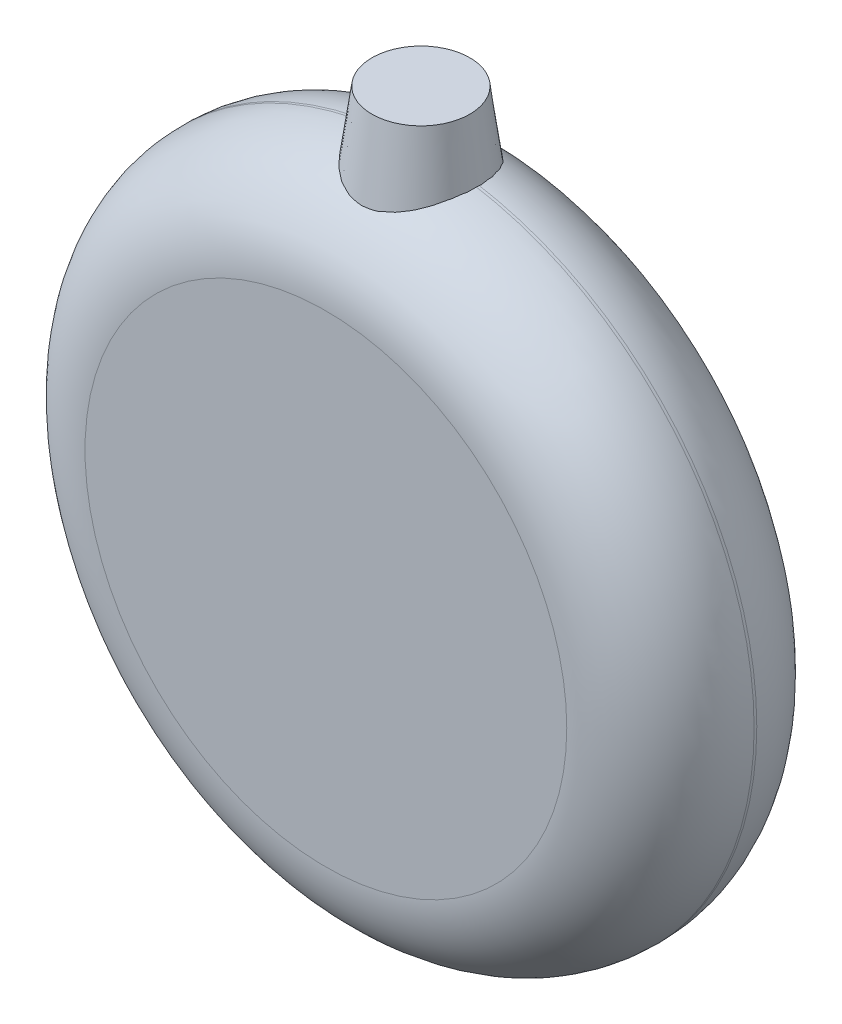
from build123d import *

# Parameters (mm, degrees)
SKETCH1_R           = 25
BOSS_EXTRUDE1_DEPTH = 7.1
BOSS_EXTRUDE2_START = 23
SKETCH4_R           = 4.5
BOSS_EXTRUDE2_DEPTH = 6
BOSS_EXTRUDE2_TAPER = 8
FILLET2_R           = 7
BOSS_EXTRUDE3_DEPTH = 0.1


with BuildPart() as part:
    # Sketch1 → Boss-Extrude1 (new, symmetric)
    with BuildSketch(Plane.XY):
        Circle(SKETCH1_R)
    extrude(amount=BOSS_EXTRUDE1_DEPTH, both=True)

    # Fillet2
    fillet2_edges = [part.edges().sort_by_distance(p)[0] for p in [
        (-25, 0, 7.1),
        (-25, 0, -7.1),
    ]]
    fillet(fillet2_edges, radius=FILLET2_R)

    # Sketch5 → Boss-Extrude3 (add)
    # profile 1 of 3: a face of its own
    with BuildSketch(Plane(origin=(0, 0, -7.1), x_dir=(-1, 0, 0), z_dir=(0, 0, -1))):
        Polygon((8.213261218, -6.2), (7.060697115, -6.2), (5.643589744, -1.875400641), (4.219030449, -6.2), (3.075160256, -6.2), (2.026923077, 0), (3.153405449, 0), (3.815384615, -3.915985577), (5.104567308, 0), (6.188822115, 0), (7.471794872, -3.915985577), (8.132532051, 0), (9.26025641, 0), align=None)
    # profile 2 of 3: a face of its own
    with BuildSketch(Plane(origin=(0, 0, -7.1), x_dir=(-1, 0, 0), z_dir=(0, 0, -1))):
        with BuildLine():
            add(Edge.make_bspline(
                [(-1.892788462, -3.338461538), (-1.957814687, -3.292016811), (-2.086528232, -3.200083664), (-2.256082423, -3.03542489), (-2.403077422, -2.852339794), (-2.525396911, -2.651423244), (-2.623116991, -2.436383636), (-2.690272417, -2.210114258), (-2.735179023, -1.976115948), (-2.739914035, -1.81682388), (-2.742307692, -1.736298077)],
                knots=[0, 0, 0, 0, 1.013470425, 2.00607327, 2.989559212, 3.987547927, 4.985093546, 5.979490292, 6.978585884, 8, 8, 8, 8], degree=3))
            add(Edge.make_bspline(
                [(-2.742307692, -1.736298077), (-2.739368276, -1.649115937), (-2.733538321, -1.476201353), (-2.681865938, -1.222652923), (-2.599340208, -0.97929684), (-2.485494527, -0.74900875), (-2.34341316, -0.538132911), (-2.178774834, -0.349954761), (-1.989121967, -0.192777785), (-1.813970357, -0.084612696), (-1.662159308, -0.014438799), (-1.540636051, 0.033468366), (-1.410221464, 0.071230849), (-1.273091306, 0.103710579), (-1.127814736, 0.128061881), (-0.975821963, 0.147231139), (-0.815688033, 0.156527408), (-0.706699573, 0.158144818), (-0.650801282, 0.158974359)],
                knots=[0, 0, 0, 0, 1.313633616, 2.605423678, 3.884827599, 5.180399172, 6.467003699, 7.709825993, 8.937691468, 10.168030689, 10.802071053, 11.45831639, 12.135866991, 12.84764728, 13.582572811, 14.35620613, 15.156926628, 16, 16, 16, 16], degree=3))
            add(Edge.make_bspline(
                [(-0.650801282, 0.158974359), (-0.591176124, 0.158160994), (-0.474739947, 0.156572652), (-0.304750979, 0.147085787), (-0.144467791, 0.12925788), (0.006835878, 0.106827755), (0.147772465, 0.073519785), (0.28021432, 0.037309023), (0.402728778, -0.007674839), (0.55248756, -0.077055439), (0.726079973, -0.18081648), (0.911348168, -0.33594284), (1.076422799, -0.517827085), (1.214675963, -0.727771842), (1.329877805, -0.95685246), (1.412093921, -1.203917306), (1.461614276, -1.465629795), (1.467511337, -1.645001531), (1.470512821, -1.736298077)],
                knots=[0, 0, 0, 0, 0.887187828, 1.732502891, 2.531768656, 3.28622382, 4.00645991, 4.68503301, 5.328123524, 5.945476897, 7.13918604, 8.324554323, 9.528234031, 10.780485522, 12.053158567, 13.332907357, 14.642504384, 16, 16, 16, 16], degree=3))
            add(Edge.make_bspline(
                [(1.470512821, -1.736298077), (1.468464894, -1.815975357), (1.464438103, -1.972643002), (1.422555417, -2.20130756), (1.358699234, -2.42001094), (1.265373076, -2.626739984), (1.148202994, -2.823996227), (1.002257938, -3.007732339), (0.832518432, -3.182446151), (0.703346025, -3.285593788), (0.637139423, -3.338461538)],
                knots=[0, 0, 0, 0, 1.017680362, 2.001042016, 2.962316111, 3.924347734, 4.892953533, 5.888308623, 6.917664266, 8, 8, 8, 8], degree=3))
            add(Edge.make_bspline(
                [(0.637139423, -3.338461538), (0.678186098, -3.385777204), (0.758994639, -3.478927498), (0.863290645, -3.628969605), (0.952293467, -3.783363075), (1.024111976, -3.943021129), (1.08185441, -4.10610318), (1.123389488, -4.273612859), (1.147010007, -4.446052142), (1.150700193, -4.562577452), (1.152564103, -4.621434295)],
                knots=[0, 0, 0, 0, 1.06167017, 2.090108827, 3.093337593, 4.079993162, 5.054811602, 6.023746282, 7.001795783, 8, 8, 8, 8], degree=3))
            add(Edge.make_bspline(
                [(1.152564103, -4.621434295), (1.150112139, -4.70111505), (1.145274509, -4.858322112), (1.101637153, -5.08842811), (1.030800778, -5.30783801), (0.930868786, -5.513666333), (0.80789391, -5.703971348), (0.659018726, -5.872201561), (0.488632691, -6.019204755), (0.295733787, -6.141936244), (0.083723613, -6.238919389), (-0.145068883, -6.30863371), (-0.389588161, -6.351912974), (-0.558297189, -6.356584756), (-0.644591346, -6.358974359)],
                knots=[0, 0, 0, 0, 1.022461855, 2.017277858, 2.995792987, 3.975491763, 4.947267477, 5.896545572, 6.850353789, 7.828175386, 8.82259352, 9.83498435, 10.892601059, 12, 12, 12, 12], degree=3))
            add(Edge.make_bspline(
                [(-0.644591346, -6.358974359), (-0.729643143, -6.356587798), (-0.895476337, -6.351934505), (-1.13607554, -6.308777181), (-1.36065208, -6.237585479), (-1.568897257, -6.139320705), (-1.759112416, -6.015162575), (-1.926474112, -5.863709674), (-2.074742434, -5.691072532), (-2.199123011, -5.496265438), (-2.299213401, -5.28637646), (-2.372329681, -5.065847341), (-2.41520943, -4.837132591), (-2.42129693, -4.682052535), (-2.424358974, -4.604046474)],
                knots=[0, 0, 0, 0, 1.094374825, 2.133801765, 3.135215957, 4.120034135, 5.089936793, 6.048819145, 7.016727444, 8.011879177, 9.015716645, 10.003559944, 10.995780443, 12, 12, 12, 12], degree=3))
            add(Edge.make_bspline(
                [(-2.424358974, -4.604046474), (-2.422874682, -4.548920729), (-2.419961869, -4.440740576), (-2.398504052, -4.281337306), (-2.362161226, -4.12848021), (-2.312178738, -3.977874953), (-2.239791819, -3.82752305), (-2.147258016, -3.670164137), (-2.029589753, -3.505487402), (-1.939825056, -3.395890293), (-1.892788462, -3.338461538)],
                knots=[0, 0, 0, 0, 0.940860718, 1.84636882, 2.739437118, 3.619946589, 4.54937856, 5.582024627, 6.73298378, 8, 8, 8, 8], degree=3))
        make_face()
        with BuildLine():
            add(Edge.make_bspline(
                [(-0.617267628, -5.246153846), (-0.571459667, -5.243904051), (-0.481955663, -5.239508185), (-0.354838344, -5.201203477), (-0.240348308, -5.138433777), (-0.141523699, -5.051270736), (-0.061231444, -4.944360183), (-0.001200694, -4.822499997), (0.03405908, -4.686315581), (0.037811906, -4.591005724), (0.03974359, -4.541947115)],
                knots=[0, 0, 0, 0, 1.017635784, 1.98835473, 2.924394675, 3.903775679, 4.896969949, 5.881752986, 6.909679918, 8, 8, 8, 8], degree=3))
            add(Edge.make_bspline(
                [(0.03974359, -4.541947115), (0.037335249, -4.49247752), (0.032632731, -4.395883365), (-0.00353321, -4.256789636), (-0.067449455, -4.131536891), (-0.153183263, -4.021865677), (-0.254698177, -3.9292414), (-0.372493242, -3.863446269), (-0.501419437, -3.821366398), (-0.592097884, -3.817406038), (-0.63838141, -3.815384615)],
                knots=[0, 0, 0, 0, 1.071109905, 2.091445327, 3.086230388, 4.096303754, 5.093673306, 6.041538876, 7.0003745, 8, 8, 8, 8], degree=3))
            add(Edge.make_bspline(
                [(-0.63838141, -3.815384615), (-0.685438055, -3.817528101), (-0.777113228, -3.821704014), (-0.907994286, -3.861479186), (-1.024674944, -3.928043612), (-1.126528484, -4.017333263), (-1.209011289, -4.127923021), (-1.269570508, -4.255177634), (-1.304450648, -4.398539874), (-1.309118068, -4.498700524), (-1.311538462, -4.550641026)],
                knots=[0, 0, 0, 0, 1.008985882, 1.965693801, 2.905634363, 3.876216071, 4.854591133, 5.849205062, 6.884658104, 8, 8, 8, 8], degree=3))
            add(Edge.make_bspline(
                [(-1.311538462, -4.550641026), (-1.309236724, -4.599727075), (-1.30478024, -4.694764453), (-1.26798601, -4.830057774), (-1.207128739, -4.950869251), (-1.123699984, -5.055701809), (-1.019878561, -5.140660938), (-0.899117042, -5.203065679), (-0.762566523, -5.239278206), (-0.666749413, -5.243812335), (-0.617267628, -5.246153846)],
                knots=[0, 0, 0, 0, 1.066147256, 2.064208482, 3.022454516, 3.989792431, 4.955788801, 5.918128389, 6.924881755, 8, 8, 8, 8], degree=3))
        make_face(mode=Mode.SUBTRACT)
        with BuildLine():
            add(Edge.make_bspline(
                [(-0.653285256, -2.702564103), (-0.618463437, -2.701998985), (-0.549830066, -2.700885147), (-0.449006753, -2.687556079), (-0.351856618, -2.668633518), (-0.260081883, -2.63915252), (-0.17125124, -2.604713195), (-0.087607019, -2.559740057), (-0.007716071, -2.507497834), (0.066697707, -2.447968592), (0.133971385, -2.382693163), (0.194606991, -2.314596997), (0.244169332, -2.241939116), (0.285442612, -2.167129786), (0.31860601, -2.089577442), (0.340529503, -2.008004631), (0.354645169, -1.92349776), (0.356670619, -1.865935102), (0.357692308, -1.836899038)],
                knots=[0, 0, 0, 0, 1.129662435, 2.226550525, 3.296682235, 4.33815786, 5.351414921, 6.385493299, 7.41431807, 8.4469981, 9.473537958, 10.454642902, 11.401552439, 12.321859429, 13.225429467, 14.131893492, 15.057679712, 16, 16, 16, 16], degree=3))
            add(Edge.make_bspline(
                [(0.357692308, -1.836899038), (0.357203067, -1.80661847), (0.35623272, -1.746560709), (0.341678587, -1.658881049), (0.320554467, -1.574398943), (0.291438262, -1.493353517), (0.250191135, -1.417385282), (0.203445066, -1.343528758), (0.146969155, -1.273789003), (0.082841251, -1.208612376), (0.012104759, -1.148593337), (-0.065230118, -1.096711702), (-0.147538514, -1.051228122), (-0.236027392, -1.015430623), (-0.32978947, -0.988265582), (-0.428256169, -0.968594428), (-0.532046612, -0.955480135), (-0.603149905, -0.954400149), (-0.639623397, -0.953846154)],
                knots=[0, 0, 0, 0, 0.974019005, 1.931846162, 2.853358636, 3.777086404, 4.695411081, 5.630991801, 6.588726176, 7.578582455, 8.572023234, 9.570371685, 10.572628972, 11.595075622, 12.6370648, 13.711634473, 14.826148828, 16, 16, 16, 16], degree=3))
            add(Edge.make_bspline(
                [(-0.639623397, -0.953846154), (-0.676500136, -0.954514587), (-0.74836122, -0.955817151), (-0.853407641, -0.9673294), (-0.95276304, -0.985595886), (-1.046308155, -1.01172157), (-1.134398809, -1.045188393), (-1.21584587, -1.087789435), (-1.292536172, -1.136052764), (-1.361906445, -1.192496018), (-1.425107886, -1.253395302), (-1.478783649, -1.320975503), (-1.527045962, -1.390935806), (-1.563358298, -1.467791054), (-1.594457744, -1.547077757), (-1.61294168, -1.631813235), (-1.628304209, -1.720014738), (-1.629087148, -1.780933669), (-1.629487179, -1.812059295)],
                knots=[0, 0, 0, 0, 1.200730299, 2.339843079, 3.437336227, 4.487507367, 5.49914389, 6.500211663, 7.47645343, 8.445123332, 9.408146062, 10.328401978, 11.252108805, 12.168702489, 13.09034032, 14.019150537, 14.98791428, 16, 16, 16, 16], degree=3))
            add(Edge.make_bspline(
                [(-1.629487179, -1.812059295), (-1.628350331, -1.843140597), (-1.626128188, -1.903893773), (-1.613986074, -1.993618251), (-1.591154275, -2.078647046), (-1.561463038, -2.161101002), (-1.521395481, -2.238520575), (-1.474035825, -2.313276119), (-1.416154563, -2.382161223), (-1.352172598, -2.448284711), (-1.280254922, -2.507450258), (-1.203085682, -2.559341618), (-1.122715244, -2.605005569), (-1.036558645, -2.639103048), (-0.947304107, -2.668647335), (-0.852609378, -2.687555078), (-0.754266388, -2.700888199), (-0.687280451, -2.701999911), (-0.653285256, -2.702564103)],
                knots=[0, 0, 0, 0, 1.011607766, 1.977342622, 2.937803287, 3.871057497, 4.822789971, 5.768019373, 6.744124207, 7.744188914, 8.758214762, 9.766859222, 10.76764927, 11.758144632, 12.776187854, 13.822267547, 14.894806271, 16, 16, 16, 16], degree=3))
        make_face(mode=Mode.SUBTRACT)
    # profile 3 of 3: a face of its own
    with BuildSketch(Plane(origin=(0, 0, -7.1), x_dir=(-1, 0, 0), z_dir=(0, 0, -1))):
        Polygon((-3.775641026, -6.2), (-4.777924679, -6.2), (-7.591025641, -2.120072115), (-7.591025641, -6.2), (-8.703846154, -6.2), (-8.703846154, 0), (-7.694110577, 0), (-4.888461538, -4.067508013), (-4.888461538, 0), (-3.775641026, 0), align=None)
    extrude(amount=BOSS_EXTRUDE3_DEPTH)


with BuildPart() as body_2:
    # Sketch4 → Boss-Extrude2 (new body)
    with BuildSketch(Plane(origin=(0, 0, 0), x_dir=(1, 0, 0), z_dir=(0, 1, 0)).offset(BOSS_EXTRUDE2_START)):
        Circle(SKETCH4_R)
    extrude(amount=BOSS_EXTRUDE2_DEPTH, taper=BOSS_EXTRUDE2_TAPER)


solid = Compound([part.part, body_2.part])
